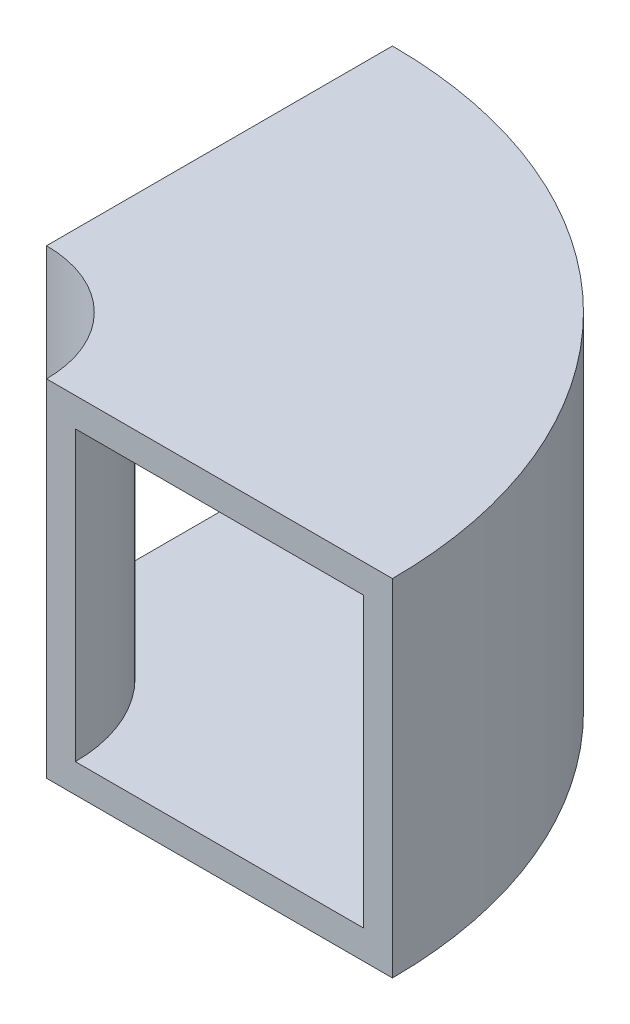
from build123d import *

# Parameters (mm, degrees)
SKETCH_1_W          = 12
SKETCH_1_H          = 12
SKETCH_1_W_2        = 10
SKETCH_1_H_2        = 10
THINREVOLVE90_ANGLE = 90


with BuildPart() as part:
    # 草图1 → ThinRevolve90 (revolve)
    with BuildSketch(Plane.XY):
        with Locations((10, 5)):
            Rectangle(SKETCH_1_W, SKETCH_1_H)
        with Locations((10, 5)):
            Rectangle(SKETCH_1_W_2, SKETCH_1_H_2, mode=Mode.SUBTRACT)
    revolve(axis=Axis((0, 0, 0), (0, 1, 0)), revolution_arc=THINREVOLVE90_ANGLE)


solid = part.part
